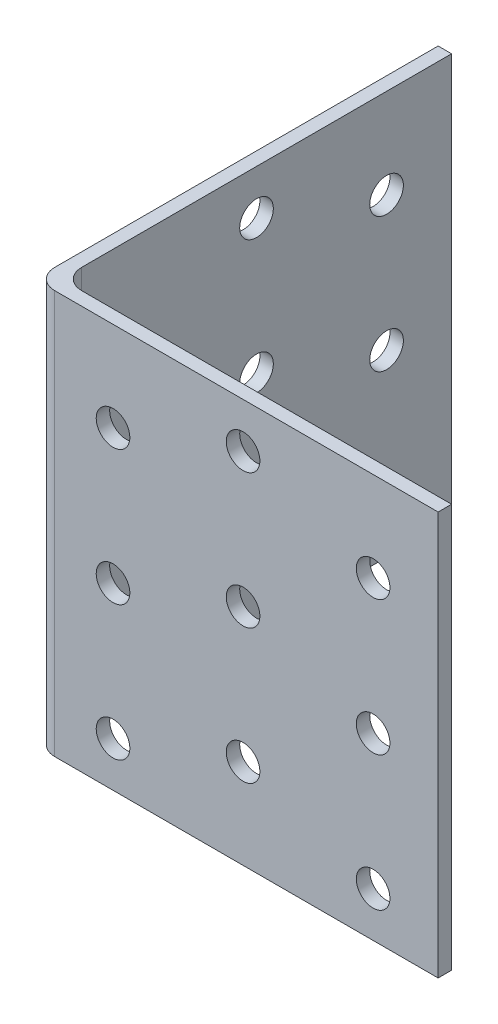
from build123d import *

# Parameters (mm, degrees)
BOSS_EXTRUDE1_DEPTH = 30
SKETCH2_R           = 2.5
CUT_EXTRUDE1_DEPTH  = 10


with BuildPart() as part:
    # Sketch1 → Boss-Extrude1 (new, symmetric)
    with BuildSketch(Plane(origin=(0, 0, 0), x_dir=(1, 0, 0), z_dir=(0, 1, 0))):
        with BuildLine():
            Line((0, 3), (0, 60))
            Line((0, 60), (2, 60))
            Line((2, 60), (2, 5))
            ThreePointArc((2, 5), (2.878679656, 2.878679656), (5, 2))
            Line((5, 2), (60, 2))
            Line((60, 2), (60, 0))
            Line((60, 0), (3, 0))
            ThreePointArc((3, 0), (0.878679656, 0.878679656), (0, 3))
        make_face()
    extrude(amount=BOSS_EXTRUDE1_DEPTH, both=True)

    # Sketch2 → Cut-Extrude1 (cut)
    with BuildSketch(Plane(origin=(0, 0, -2), x_dir=(-1, 0, 0), z_dir=(0, 0, -1))):
        with Locations((-50.333333333, -23.333333333)):
            Circle(SKETCH2_R)
        with Locations((-50.333333333, -3.333333333)):
            Circle(SKETCH2_R)
        with Locations((-50.333333333, 16.666666667)):
            Circle(SKETCH2_R)
        with Locations((-31, 23.333333333)):
            Circle(SKETCH2_R)
        with Locations((-31, 3.333333333)):
            Circle(SKETCH2_R)
        with Locations((-31, -16.666666667)):
            Circle(SKETCH2_R)
        with Locations((-11.666666667, -23.333333333)):
            Circle(SKETCH2_R)
        with Locations((-11.666666667, -3.333333333)):
            Circle(SKETCH2_R)
        with Locations((-11.666666667, 16.666666667)):
            Circle(SKETCH2_R)
    cut_extrude1 = extrude(amount=-CUT_EXTRUDE1_DEPTH, mode=Mode.SUBTRACT)

    # Mirror9: Cut-Extrude1 across plane
    add(cut_extrude1.mirror(Plane(origin=(0, 0, 0), x_dir=(-0.7071067811865488, 0, 0.7071067811865462), z_dir=(0.7071067811865465, 0, 0.7071067811865487))), mode=Mode.SUBTRACT)


solid = part.part
